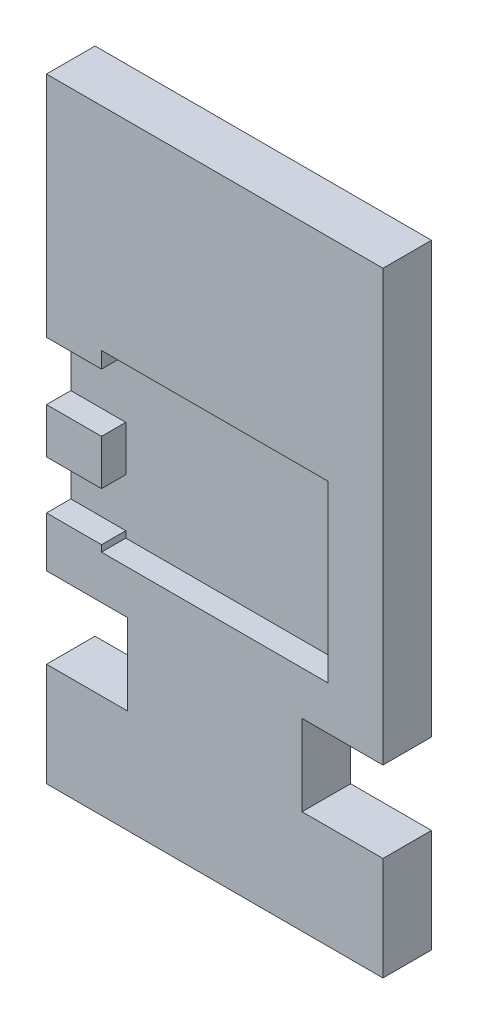
from build123d import *

# Parameters (mm, degrees)
SKETCH1_W           = 52
SKETCH1_H           = 190
BOSS_EXTRUDE1_DEPTH = 15
SKETCH2_W           = 35
SKETCH2_H           = 54
CUT_EXTRUDE1_DEPTH  = 7.5
SKETCH4_W           = 36
SKETCH4_H           = 47
CUT_EXTRUDE7_DEPTH  = 5
SKETCH9_W           = 25
SKETCH9_H           = 25
CUT_EXTRUDE8_DEPTH  = 198.557586541
SKETCH5_W           = 7.5
SKETCH5_H           = 18
SKETCH5_H_2         = 15
CUT_EXTRUDE5_DEPTH  = 20


with BuildPart() as part:
    # Sketch1 → Boss-Extrude1 (new body)
    with BuildSketch(Plane.XY):
        with Locations((26, 95)):
            Rectangle(SKETCH1_W, SKETCH1_H)
    boss_extrude1 = extrude(amount=BOSS_EXTRUDE1_DEPTH)

    # Sketch2 → Cut-Extrude1 (cut)
    with BuildSketch(Plane.XY.offset(15)):
        with Locations((34.5, 97.5)):
            Rectangle(SKETCH2_W, SKETCH2_H)
    cut_extrude1 = extrude(amount=-CUT_EXTRUDE1_DEPTH, mode=Mode.SUBTRACT)

    # Sketch4 → Cut-Extrude7 (cut)
    with BuildSketch(Plane(origin=(0, 0, 0), x_dir=(-1, 0, 0), z_dir=(0, 0, -1))):
        with Locations((-52, 156.5)):
            Rectangle(SKETCH4_W, SKETCH4_H)
    cut_extrude7 = extrude(amount=-CUT_EXTRUDE7_DEPTH, mode=Mode.SUBTRACT)

    # Sketch9 → Cut-Extrude8 (cut, through all)
    with BuildSketch(Plane.XY.offset(15)):
        with Locations((12.5, 44.5)):
            Rectangle(SKETCH9_W, SKETCH9_H)
    cut_extrude8 = extrude(amount=-CUT_EXTRUDE8_DEPTH, mode=Mode.SUBTRACT)

    # Sketch5 → Cut-Extrude5 (cut)
    with BuildSketch(Plane(origin=(17, 0, 0), x_dir=(0, 0, -1), z_dir=(1, 0, 0))):
        with Locations((-11.25, 110.5)):
            Rectangle(SKETCH5_W, SKETCH5_H)
        with Locations((-11.25, 80)):
            Rectangle(SKETCH5_W, SKETCH5_H_2)
    extrude(amount=-CUT_EXTRUDE5_DEPTH, mode=Mode.SUBTRACT)

    # Mirror4: Boss-Extrude1, Cut-Extrude1, Cut-Extrude7, Cut-Extrude8 across plane
    add(boss_extrude1.mirror(Plane(origin=(52, 0, 0), x_dir=(0, 0, 1), z_dir=(1, 0, 0))))
    add(cut_extrude1.mirror(Plane(origin=(52, 0, 0), x_dir=(0, 0, 1), z_dir=(1, 0, 0))), mode=Mode.SUBTRACT)
    add(cut_extrude7.mirror(Plane(origin=(52, 0, 0), x_dir=(0, 0, 1), z_dir=(1, 0, 0))), mode=Mode.SUBTRACT)
    add(cut_extrude8.mirror(Plane(origin=(52, 0, 0), x_dir=(0, 0, 1), z_dir=(1, 0, 0))), mode=Mode.SUBTRACT)


solid = part.part
